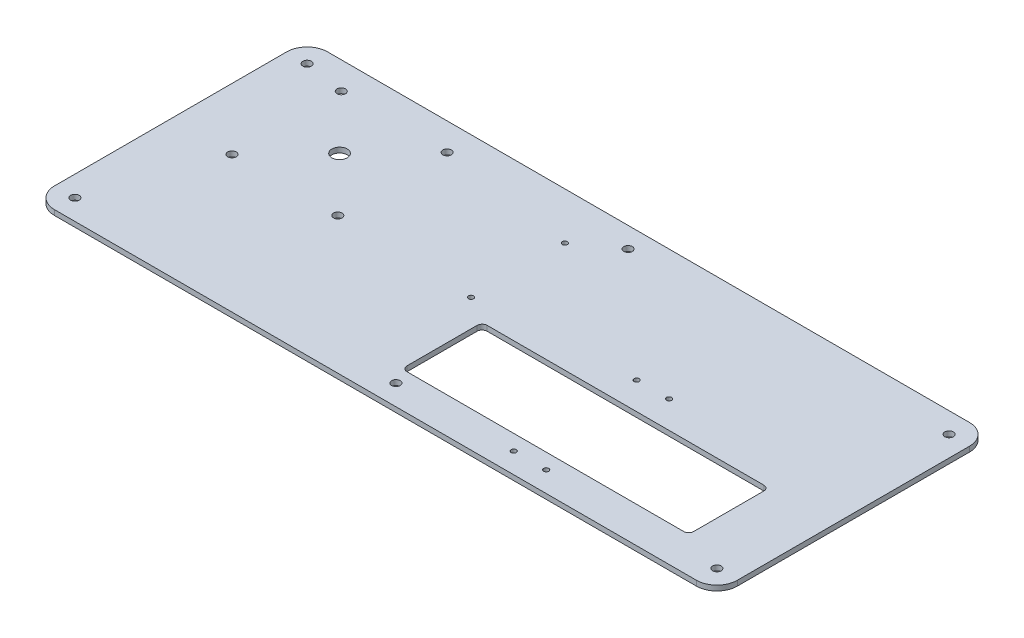
from build123d import *

# Parameters (mm, degrees)
SKETCH1_R           = 2.5
SKETCH1_R_2         = 1.5
SKETCH1_R_3         = 4.5
BOSS_EXTRUDE1_DEPTH = 3


with BuildPart() as part:
    # Sketch1 → Boss-Extrude1 (new body)
    with BuildSketch(Plane(origin=(0, 0, 0), x_dir=(1, 0, 0), z_dir=(0, 1, 0))):
        with BuildLine():
            Line((-188, -80), (188, -80))
            ThreePointArc((188, -80), (196.485281374, -76.485281374), (200, -68))
            Line((200, -68), (200, 68))
            ThreePointArc((200, 68), (196.485281374, 76.485281374), (188, 80))
            Line((188, 80), (-188, 80))
            ThreePointArc((-188, 80), (-196.485281374, 76.485281374), (-200, 68))
            Line((-200, 68), (-200, -68))
            ThreePointArc((-200, -68), (-196.485281374, -76.485281374), (-188, -80))
        make_face()
        with Locations(Location((-188, 68, 0), (0, 0, 270))):
            Circle(SKETCH1_R, mode=Mode.SUBTRACT)
        with Locations(Location((0, 68, 0), (0, 0, 270))):
            Circle(SKETCH1_R, mode=Mode.SUBTRACT)
        with Locations(Location((188, 68, 0), (0, 0, 270))):
            Circle(SKETCH1_R, mode=Mode.SUBTRACT)
        with Locations(Location((188, -68, 0), (0, 0, 270))):
            Circle(SKETCH1_R, mode=Mode.SUBTRACT)
        with Locations(Location((0, -68, 0), (0, 0, 270))):
            Circle(SKETCH1_R, mode=Mode.SUBTRACT)
        with Locations(Location((-188, -68, 0), (0, 0, 270))):
            Circle(SKETCH1_R, mode=Mode.SUBTRACT)
        with Locations(Location((-21.5, 52.5, 0), (0, 0, 270))):
            Circle(SKETCH1_R_2, mode=Mode.SUBTRACT)
        with Locations(Location((-21.5, -2.5, 0), (0, 0, 270))):
            Circle(SKETCH1_R_2, mode=Mode.SUBTRACT)
        with Locations(Location((69, 4, 0), (0, 0, 270))):
            Circle(SKETCH1_R_2, mode=Mode.SUBTRACT)
        with Locations(Location((88, 4, 0), (0, 0, 270))):
            Circle(SKETCH1_R_2, mode=Mode.SUBTRACT)
        with Locations(Location((69, -68, 0), (0, 0, 270))):
            Circle(SKETCH1_R_2, mode=Mode.SUBTRACT)
        with Locations(Location((88, -68, 0), (0, 0, 270))):
            Circle(SKETCH1_R_2, mode=Mode.SUBTRACT)
        with Locations(Location((-133, 32, 0), (0, 0, 270))):
            Circle(SKETCH1_R_3, mode=Mode.SUBTRACT)
        with Locations(Location((-164, 64, 0), (0, 0, 270))):
            Circle(SKETCH1_R, mode=Mode.SUBTRACT)
        with Locations(Location((-102, 64, 0), (0, 0, 270))):
            Circle(SKETCH1_R, mode=Mode.SUBTRACT)
        with Locations(Location((-102, 0, 0), (0, 0, 270))):
            Circle(SKETCH1_R, mode=Mode.SUBTRACT)
        with Locations(Location((-164, 0, 0), (0, 0, 270))):
            Circle(SKETCH1_R, mode=Mode.SUBTRACT)
        with BuildLine():
            Line((-2.5, -59), (159.5, -59))
            ThreePointArc((159.5, -59), (161.621320344, -58.121320344), (162.5, -56))
            Line((162.5, -56), (162.5, -15))
            ThreePointArc((162.5, -15), (161.621320344, -12.878679656), (159.5, -12))
            Line((159.5, -12), (-2.5, -12))
            ThreePointArc((-2.5, -12), (-4.621320344, -12.878679656), (-5.5, -15))
            Line((-5.5, -15), (-5.5, -56))
            ThreePointArc((-5.5, -56), (-4.621320344, -58.121320344), (-2.5, -59))
        make_face(mode=Mode.SUBTRACT)
    extrude(amount=BOSS_EXTRUDE1_DEPTH)


solid = part.part
